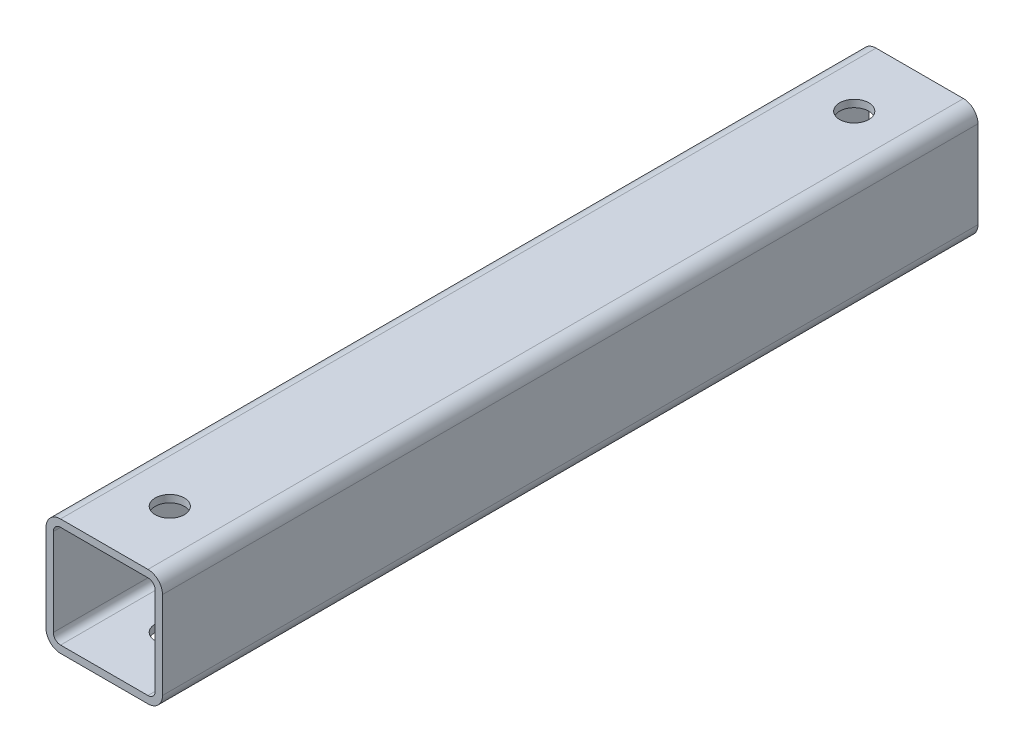
from build123d import *

# Parameters (mm, degrees)
BOSS_EXTRUDE1_DEPTH = 355.6
SKETCH2_R           = 12.7
CUT_EXTRUDE1_DEPTH  = 374.3022368


with BuildPart() as part:
    # Sketch1 → Boss-Extrude1 (new, symmetric)
    with BuildSketch(Plane.XY):
        with BuildLine():
            Line((-38.1, -50.8), (38.1, -50.8))
            ThreePointArc((38.1, -50.8), (47.080256121, -47.080256121), (50.8, -38.1))
            Line((50.8, -38.1), (50.8, 38.1))
            ThreePointArc((50.8, 38.1), (47.080256121, 47.080256121), (38.1, 50.8))
            Line((38.1, 50.8), (-38.1, 50.8))
            ThreePointArc((-38.1, 50.8), (-47.080256121, 47.080256121), (-50.8, 38.1))
            Line((-50.8, 38.1), (-50.8, -38.1))
            ThreePointArc((-50.8, -38.1), (-47.080256121, -47.080256121), (-38.1, -50.8))
        make_face()
        with BuildLine():
            Line((-38.1, 44.45), (38.1, 44.45))
            ThreePointArc((38.1, 44.45), (42.590128061, 42.590128061), (44.45, 38.1))
            Line((44.45, 38.1), (44.45, -38.1))
            ThreePointArc((44.45, -38.1), (42.590128061, -42.590128061), (38.1, -44.45))
            Line((38.1, -44.45), (-38.1, -44.45))
            ThreePointArc((-38.1, -44.45), (-42.590128061, -42.590128061), (-44.45, -38.1))
            Line((-44.45, -38.1), (-44.45, 38.1))
            ThreePointArc((-44.45, 38.1), (-42.590128061, 42.590128061), (-38.1, 44.45))
        make_face(mode=Mode.SUBTRACT)
    extrude(amount=BOSS_EXTRUDE1_DEPTH, both=True)

    # Sketch2 → Cut-Extrude1 (cut, through all)
    with BuildSketch(Plane(origin=(0, 50.8, 0), x_dir=(1, 0, 0), z_dir=(0, 1, 0))):
        with Locations(Location((0, -298.45, 0), (0, 0, 270))):
            Circle(SKETCH2_R)
        with Locations(Location((0, 298.45, 0), (0, 0, 90))):
            Circle(SKETCH2_R)
    extrude(amount=-CUT_EXTRUDE1_DEPTH, mode=Mode.SUBTRACT)


solid = part.part
